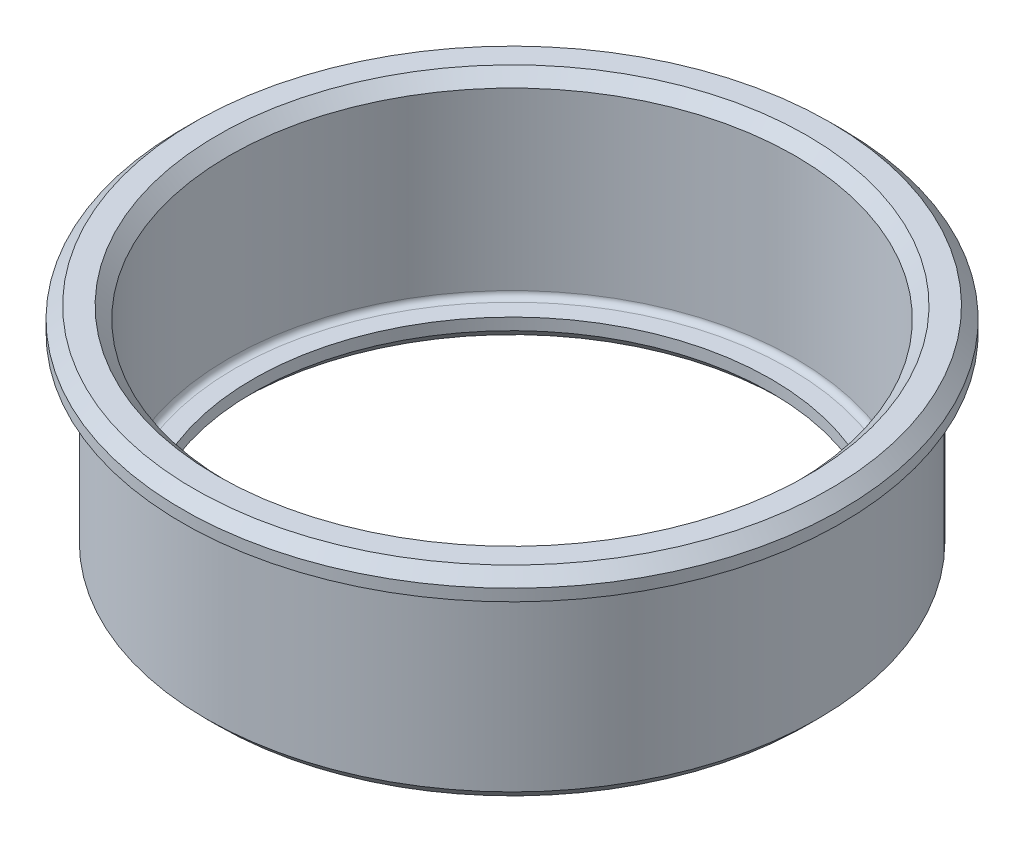
from build123d import *


with BuildPart() as part:
    # Sketch1 → Revolve1 (revolve)
    with BuildSketch(Plane(origin=(0, 0, 0), x_dir=(0, 0, -1), z_dir=(1, 0, 0))):
        with BuildLine():
            Line((11, 0), (11, -0.5))
            Line((11, -0.5), (11.5, -1))
            Line((11.5, -1), (12.5, -1))
            Line((12.5, -1), (13, -0.5))
            Line((13, -0.5), (13, 6.95))
            ThreePointArc((13, 6.95), (13.073223305, 7.126776695), (13.25, 7.2))
            Line((13.25, 7.2), (14, 7.2))
            Line((14, 7.2), (14, 7.7))
            Line((14, 7.7), (13.5, 8.2))
            Line((13.5, 8.2), (12.525, 8.2))
            Line((12.525, 8.2), (12.025, 7.7))
            Line((12.025, 7.7), (12.025, 0.25))
            ThreePointArc((12.025, 0.25), (11.951776695, 0.073223305), (11.775, 0))
            Line((11.775, 0), (11, 0))
        make_face()
    revolve(axis=Axis((0, 0, 0), (0, 1, 0)))


solid = part.part
